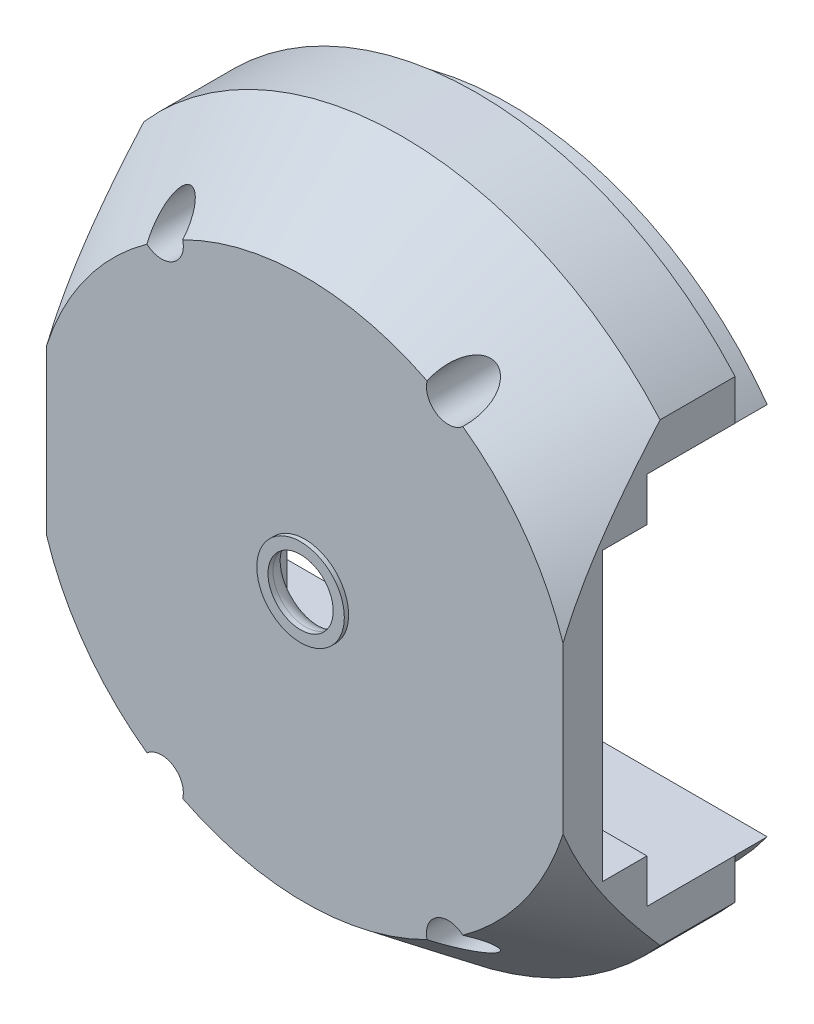
from build123d import *

# Parameters (mm, degrees)
EXTRUDE1_DEPTH      = 2.25
EXTRUDE2_DEPTH      = 12
CHAMFER1_SIZE       = 5.1
CHAMFER1_SIZE2      = 6.76792859
SKETCH6_W           = 60
SKETCH6_H           = 26.1
CUT_EXTRUDE1_DEPTH  = 8.4
SKETCH9_W           = 10
SKETCH9_H           = 40
CUT_EXTRUDE3_DEPTH  = 37.363978582
SKETCH10_W          = 44
SKETCH10_H          = 20
CUT_EXTRUDE4_DEPTH  = 3.1
CUT_EXTRUDE8_DEPTH  = 13
SKETCH16_R          = 1.525
CUT_EXTRUDE9_DEPTH  = 34.212384738
SKETCH17_R          = 2.275
CUT_EXTRUDE10_DEPTH = 34.212384908
EXTRUDE4_START      = 0.3
SKETCH18_R          = 3.05
SKETCH18_R_2        = 2.275
EXTRUDE4_DEPTH      = 0.3
FILLET1_R           = 1.2


with BuildPart() as part:
    # Sketch1 → Extrude1 (new body)
    with BuildSketch(Plane.XY):
        with BuildLine():
            ThreePointArc((-22.224984725, -0.026057486), (0.013028745, -22.224996181), (22.225, 0))
            ThreePointArc((22.225, 0), (-0.013028745, 22.224996181), (-22.224984725, -0.026057486))
        make_face()
    extrude(amount=EXTRUDE1_DEPTH)

    # Sketch2 → Extrude2 (add)
    with BuildSketch(Plane.XY.offset(2.25)):
        with BuildLine():
            ThreePointArc((-23.999872331, -0.078282234), (0.113586787, -23.999731208), (23.999538151, 0.148891095))
            ThreePointArc((23.999538151, 0.148891095), (-0.113586787, 23.999731208), (-23.999872331, -0.078282234))
        make_face()
    extrude(amount=EXTRUDE2_DEPTH)

    # Chamfer1
    chamfer1_edges = [part.edges().sort_by_distance(p)[0] for p in [
        (-23.999538151, -0.148891095, 14.25),
    ]]
    chamfer1_side = [part.faces().sort_by_distance(p)[0] for p in [
        (0, 0, 14.25),
    ]]
    chamfer(chamfer1_edges, length=CHAMFER1_SIZE, length2=CHAMFER1_SIZE2, reference=chamfer1_side[0])

    # Sketch6 → Cut-Extrude1 (cut)
    with BuildSketch(Plane(origin=(0, 0, 0), x_dir=(-1, 0, 0), z_dir=(0, 0, -1))):
        Rectangle(SKETCH6_W, SKETCH6_H)
    extrude(amount=-CUT_EXTRUDE1_DEPTH, mode=Mode.SUBTRACT)

    # Sketch9 → Cut-Extrude3 (cut, through all)
    with BuildSketch(Plane(origin=(0, 0, 0), x_dir=(-1, 0, 0), z_dir=(0, 0, -1))):
        with Locations((-23, 0)):
            Rectangle(SKETCH9_W, SKETCH9_H)
        with Locations((23, 0)):
            Rectangle(SKETCH9_W, SKETCH9_H)
    extrude(amount=-CUT_EXTRUDE3_DEPTH, mode=Mode.SUBTRACT)

    # Sketch10 → Cut-Extrude4 (cut)
    with BuildSketch(Plane(origin=(0, 0, 8.4), x_dir=(-1, 0, 0), z_dir=(0, 0, -1))):
        Rectangle(SKETCH10_W, SKETCH10_H)
    extrude(amount=-CUT_EXTRUDE4_DEPTH, mode=Mode.SUBTRACT)

    # Sketch15 → Cut-Extrude8 (cut)
    with BuildSketch(Plane(origin=(0, 0, 0), x_dir=(-1, 0, 0), z_dir=(0, 0, -1))):
        with BuildLine():
            Line((4, -13), (4, 13))
            ThreePointArc((4, 13), (0, 17), (-4, 13))
            Line((-4, 13), (-4, -13))
            ThreePointArc((-4, -13), (0, -17), (4, -13))
        make_face()
    extrude(amount=-CUT_EXTRUDE8_DEPTH, mode=Mode.SUBTRACT)

    # Sketch16 → Cut-Extrude9 (cut, through all)
    with BuildSketch(Plane(origin=(0, 0, 0), x_dir=(-1, 0, 0), z_dir=(0, 0, -1))):
        with Locations((-10, -16.5)):
            Circle(SKETCH16_R)
        with Locations(Location((10, -16.5, 0), (0, 0, 48.382100449))):
            Circle(SKETCH16_R)
        with Locations((10, 16.5)):
            Circle(SKETCH16_R)
        with Locations(Location((-10, 16.5, 0), (0, 0, 14.054705204))):
            Circle(SKETCH16_R)
    extrude(amount=-CUT_EXTRUDE9_DEPTH, mode=Mode.SUBTRACT)

    # Sketch17 → Cut-Extrude10 (cut, through all)
    with BuildSketch(Plane.XY.offset(14.25)):
        Circle(SKETCH17_R)
    extrude(amount=-CUT_EXTRUDE10_DEPTH, mode=Mode.SUBTRACT)

    # Sketch18 → Extrude4 (add)
    with BuildSketch(Plane.XY.offset(14.25).offset(EXTRUDE4_START)):
        with Locations(Location((0, 0, 0), (0, 0, 180))):
            Circle(SKETCH18_R)
        Circle(SKETCH18_R_2, mode=Mode.SUBTRACT)
    extrude(amount=-EXTRUDE4_DEPTH)

    # Fillet1
    fillet1_edges = [part.edges().sort_by_distance(p)[0] for p in [
        (-2.275, 0, 13),
    ]]
    fillet(fillet1_edges, radius=FILLET1_R)


solid = part.part
